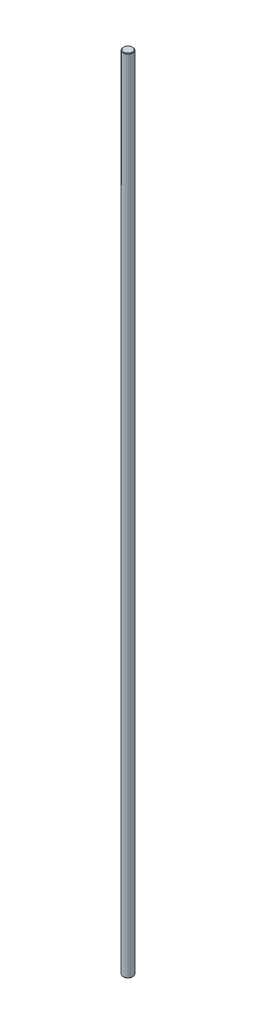
from build123d import *

# Parameters (mm, degrees)
SZKIC1_R                    = 2.5
DODANIE_WYCI_GNI_CIE1_DEPTH = 411
SFAZOWANIE1_SIZE            = 0.25


with BuildPart() as part:
    # Szkic1 → Dodanie-wyciągnięcie1 (new body)
    with BuildSketch(Plane(origin=(0, 0, 0), x_dir=(1, 0, 0), z_dir=(0, 1, 0))):
        with Locations(Location((0, 0, 0), (0, 0, 270))):
            Circle(SZKIC1_R)
    extrude(amount=DODANIE_WYCI_GNI_CIE1_DEPTH)

    # Sfazowanie1
    sfazowanie1_edges = [part.edges().sort_by_distance(p)[0] for p in [
        (0, 0, -2.5),
        (0, 411, -2.5),
    ]]
    chamfer(sfazowanie1_edges, length=SFAZOWANIE1_SIZE)


solid = part.part
